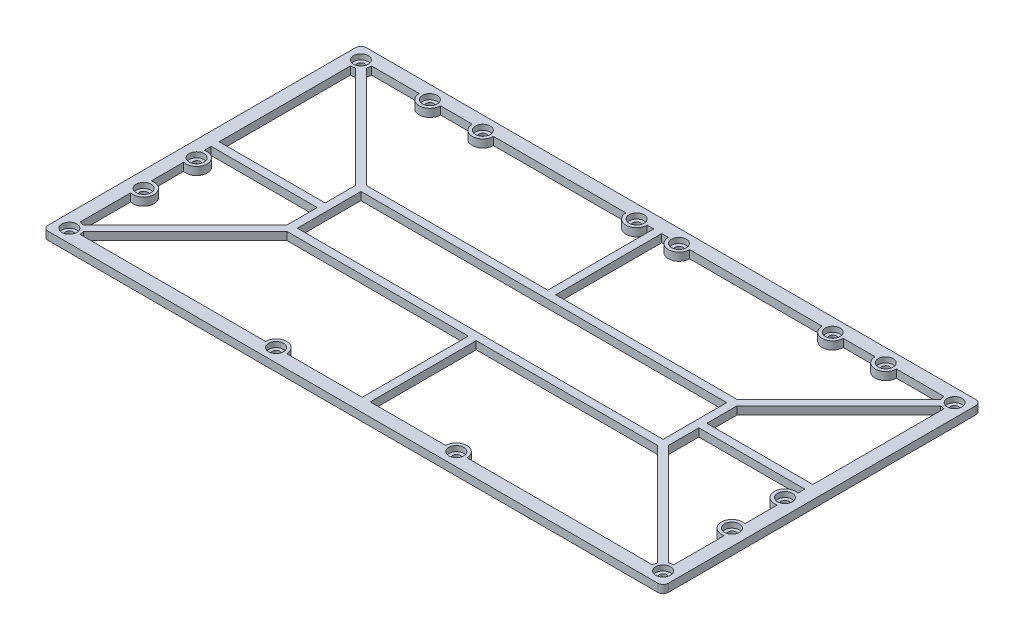
from build123d import *

# Parameters (mm, degrees)
SKETCH_1_W          = 234
SKETCH_1_H          = 120
SKETCH_1_R          = 45
EXTRUDE_1_DEPTH     = 3
SKETCH_2_R          = 1.5
CUT_EXTRUDE_1_DEPTH = 3
SKETCH_3_R          = 1.5
CUT_EXTRUDE_2_DEPTH = 3
SKETCH_4_R          = 1.5
CUT_EXTRUDE_3_DEPTH = 3
SKETCH_5_R          = 1.5
CUT_EXTRUDE_4_DEPTH = 3
FILLET_1_R          = 2
CUT_EXTRUDE_5_DEPTH = 10
EXTRUDE_START       = 17
SKETCH_7_R          = 1.5
EXTRUDE_2_DEPTH     = 17
CUT_EXTRUDE_6_DEPTH = 50
EXTRUDE_START_2     = 20
SKETCH_9_W          = 234
SKETCH_9_H          = 120
SKETCH_9_R          = 1.5
SKETCH_9_W_2        = 138
SKETCH_9_H_2        = 24
EXTRUDE_3_DEPTH     = 3
SKETCH_10_W         = 388.421700004
SKETCH_10_H         = 217.9083871
CUT_EXTRUDE_7_DEPTH = 90
FILLET_2_R          = 2
SKETCH_11_R         = 2.8
CUT_EXTRUDE_8_DEPTH = 2


with BuildPart() as part:
    # 草图1 → 凸台-拉伸1 (new body)
    with BuildSketch(Plane(origin=(0, 0, 0), x_dir=(1, 0, 0), z_dir=(0, 1, 0))):
        Rectangle(SKETCH_1_W, SKETCH_1_H)
        with Locations(Location((-58.5, 0, 0), (0, 0, 270))):
            Circle(SKETCH_1_R, mode=Mode.SUBTRACT)
        with Locations(Location((58.5, 0, 0), (0, 0, 90))):
            Circle(SKETCH_1_R, mode=Mode.SUBTRACT)
    extrude(amount=EXTRUDE_1_DEPTH)

    # 草图2 → 切除-拉伸1 (cut)
    with BuildSketch(Plane(origin=(0, 3, 0), x_dir=(1, 0, 0), z_dir=(0, 1, 0))):
        with Locations(Location((-88.5, -40, 0), (0, 0, 270))):
            Circle(SKETCH_2_R)
        with Locations(Location((-83.5, 43.301270189, 0), (0, 0, 270))):
            Circle(SKETCH_2_R)
        with Locations(Location((-33.5, 43.301270189, 0), (0, 0, 90))):
            Circle(SKETCH_2_R)
        with Locations(Location((-28.5, -40, 0), (0, 0, 90))):
            Circle(SKETCH_2_R)
        with Locations(Location((28.5, -40, 0), (0, 0, 270))):
            Circle(SKETCH_2_R)
        with Locations(Location((88.5, -40, 0), (0, 0, 90))):
            Circle(SKETCH_2_R)
        with Locations(Location((33.5, 43.301270189, 0), (0, 0, 270))):
            Circle(SKETCH_2_R)
        with Locations(Location((83.5, 43.301270189, 0), (0, 0, 90))):
            Circle(SKETCH_2_R)
    extrude(amount=-CUT_EXTRUDE_1_DEPTH, mode=Mode.SUBTRACT)

    # 草图3 → 切除-拉伸2 (cut)
    with BuildSketch(Plane(origin=(0, 3, 0), x_dir=(1, 0, 0), z_dir=(0, 1, 0))):
        with Locations(Location((-111, -28, 0), (0, 0, 270))):
            Circle(SKETCH_3_R)
        with Locations(Location((-111, -8, 0), (0, 0, 270))):
            Circle(SKETCH_3_R)
        with Locations(Location((111, -8, 0), (0, 0, 90))):
            Circle(SKETCH_3_R)
        with Locations(Location((111, -28, 0), (0, 0, 90))):
            Circle(SKETCH_3_R)
        with Locations(Location((-86, 55, 0), (0, 0, 270))):
            Circle(SKETCH_3_R)
        with Locations(Location((-66, 55, 0), (0, 0, 270))):
            Circle(SKETCH_3_R)
        with Locations(Location((66, 55, 0), (0, 0, 90))):
            Circle(SKETCH_3_R)
        with Locations(Location((86, 55, 0), (0, 0, 90))):
            Circle(SKETCH_3_R)
    extrude(amount=-CUT_EXTRUDE_2_DEPTH, mode=Mode.SUBTRACT)

    # 草图4 → 切除-拉伸3 (cut)
    with BuildSketch(Plane(origin=(0, 3, 0), x_dir=(1, 0, 0), z_dir=(0, 1, 0))):
        with Locations(Location((-112, -55, 0), (0, 0, 270))):
            Circle(SKETCH_4_R)
        with Locations(Location((-112, 55, 0), (0, 0, 270))):
            Circle(SKETCH_4_R)
        with Locations(Location((112, 55, 0), (0, 0, 270))):
            Circle(SKETCH_4_R)
        with Locations(Location((112, -55, 0), (0, 0, 270))):
            Circle(SKETCH_4_R)
        with Locations(Location((-34, -55, 0), (0, 0, 270))):
            Circle(SKETCH_4_R)
        with Locations(Location((34, -55, 0), (0, 0, 270))):
            Circle(SKETCH_4_R)
    extrude(amount=-CUT_EXTRUDE_3_DEPTH, mode=Mode.SUBTRACT)

    # 草图5 → 切除-拉伸4 (cut)
    with BuildSketch(Plane(origin=(0, 3, 0), x_dir=(1, 0, 0), z_dir=(0, 1, 0))):
        with Locations(Location((-8, 55, 0), (0, 0, 270))):
            Circle(SKETCH_5_R)
        with Locations(Location((8, 55, 0), (0, 0, 270))):
            Circle(SKETCH_5_R)
    extrude(amount=-CUT_EXTRUDE_4_DEPTH, mode=Mode.SUBTRACT)

    # 圆角1
    fillet_1_edges = [part.edges().sort_by_distance(p)[0] for p in [
        (117, 1.5, 60),
        (-117, 1.5, 60),
        (-117, 1.5, -60),
        (117, 1.5, -60),
    ]]
    fillet(fillet_1_edges, radius=FILLET_1_R)

    # 草图6 → 切除-拉伸5 (cut)
    with BuildSketch(Plane(origin=(0, 3, 0), x_dir=(1, 0, 0), z_dir=(0, 1, 0))):
        with BuildLine():
            Line((109.5, -12.769696007), (109.5, -23.230303993))
            ThreePointArc((109.5, -23.230303993), (106, -28), (109.5, -32.769696007))
            Line((109.5, -32.769696007), (109.5, -50.669872981))
            ThreePointArc((109.5, -50.669872981), (108.464466094, -51.464466094), (107.669872981, -52.5))
            Line((107.669872981, -52.5), (38.330127019, -52.5))
            ThreePointArc((38.330127019, -52.5), (34, -50), (29.669872981, -52.5))
            Line((29.669872981, -52.5), (-29.669872981, -52.5))
            ThreePointArc((-29.669872981, -52.5), (-34, -50), (-38.330127019, -52.5))
            Line((-38.330127019, -52.5), (-107.669872981, -52.5))
            ThreePointArc((-107.669872981, -52.5), (-108.464466094, -51.464466094), (-109.5, -50.669872981))
            Line((-109.5, -50.669872981), (-109.5, -32.769696007))
            ThreePointArc((-109.5, -32.769696007), (-106, -28), (-109.5, -23.230303993))
            Line((-109.5, -23.230303993), (-109.5, -12.769696007))
            ThreePointArc((-109.5, -12.769696007), (-106, -8), (-109.5, -3.230303993))
            Line((-109.5, -3.230303993), (-109.5, 50.669872981))
            ThreePointArc((-109.5, 50.669872981), (-108.464466094, 51.464466094), (-107.669872981, 52.5))
            Line((-107.669872981, 52.5), (-90.330127019, 52.5))
            ThreePointArc((-90.330127019, 52.5), (-86, 50), (-81.669872981, 52.5))
            Line((-81.669872981, 52.5), (-70.330127019, 52.5))
            ThreePointArc((-70.330127019, 52.5), (-66, 50), (-61.669872981, 52.5))
            Line((-61.669872981, 52.5), (-12.330127019, 52.5))
            ThreePointArc((-12.330127019, 52.5), (-8, 50), (-3.669872981, 52.5))
            Line((-3.669872981, 52.5), (3.669872981, 52.5))
            ThreePointArc((3.669872981, 52.5), (8, 50), (12.330127019, 52.5))
            Line((12.330127019, 52.5), (61.669872981, 52.5))
            ThreePointArc((61.669872981, 52.5), (66, 50), (70.330127019, 52.5))
            Line((70.330127019, 52.5), (81.669872981, 52.5))
            ThreePointArc((81.669872981, 52.5), (86, 50), (90.330127019, 52.5))
            Line((90.330127019, 52.5), (107.669872981, 52.5))
            ThreePointArc((107.669872981, 52.5), (108.464466094, 51.464466094), (109.5, 50.669872981))
            Line((109.5, 50.669872981), (109.5, -3.230303993))
            ThreePointArc((109.5, -3.230303993), (106, -8), (109.5, -12.769696007))
        make_face()
    extrude(amount=-CUT_EXTRUDE_5_DEPTH, mode=Mode.SUBTRACT)

    # 草图7 → 凸台-拉伸2 (add)
    with BuildSketch(Plane(origin=(0, 3, 0), x_dir=(1, 0, 0), z_dir=(0, 1, 0)).offset(EXTRUDE_START)):
        with BuildLine():
            Line((-117, 58), (-117, -58))
            ThreePointArc((-117, -58), (-116.414213562, -59.414213562), (-115, -60))
            Line((-115, -60), (115, -60))
            ThreePointArc((115, -60), (116.414213562, -59.414213562), (117, -58))
            Line((117, -58), (117, 58))
            ThreePointArc((117, 58), (116.414213562, 59.414213562), (115, 60))
            Line((115, 60), (-115, 60))
            ThreePointArc((-115, 60), (-116.414213562, 59.414213562), (-117, 58))
        make_face()
        with Locations(Location((112, -55, 0), (0, 0, 270))):
            Circle(SKETCH_7_R, mode=Mode.SUBTRACT)
        with Locations(Location((111, -28, 0), (0, 0, 270))):
            Circle(SKETCH_7_R, mode=Mode.SUBTRACT)
        with Locations(Location((111, -8, 0), (0, 0, 270))):
            Circle(SKETCH_7_R, mode=Mode.SUBTRACT)
        with Locations(Location((112, 55, 0), (0, 0, 270))):
            Circle(SKETCH_7_R, mode=Mode.SUBTRACT)
        with Locations(Location((34, -55, 0), (0, 0, 270))):
            Circle(SKETCH_7_R, mode=Mode.SUBTRACT)
        with Locations(Location((-34, -55, 0), (0, 0, 270))):
            Circle(SKETCH_7_R, mode=Mode.SUBTRACT)
        with Locations(Location((86, 55, 0), (0, 0, 270))):
            Circle(SKETCH_7_R, mode=Mode.SUBTRACT)
        with Locations(Location((66, 55, 0), (0, 0, 270))):
            Circle(SKETCH_7_R, mode=Mode.SUBTRACT)
        with Locations(Location((8, 55, 0), (0, 0, 270))):
            Circle(SKETCH_7_R, mode=Mode.SUBTRACT)
        with Locations(Location((-8, 55, 0), (0, 0, 270))):
            Circle(SKETCH_7_R, mode=Mode.SUBTRACT)
        with Locations(Location((-66, 55, 0), (0, 0, 270))):
            Circle(SKETCH_7_R, mode=Mode.SUBTRACT)
        with Locations(Location((-86, 55, 0), (0, 0, 270))):
            Circle(SKETCH_7_R, mode=Mode.SUBTRACT)
        with Locations(Location((-112, 55, 0), (0, 0, 270))):
            Circle(SKETCH_7_R, mode=Mode.SUBTRACT)
        with Locations(Location((-112, -55, 0), (0, 0, 270))):
            Circle(SKETCH_7_R, mode=Mode.SUBTRACT)
        with Locations(Location((-111, -28, 0), (0, 0, 270))):
            Circle(SKETCH_7_R, mode=Mode.SUBTRACT)
        with Locations(Location((-111, -8, 0), (0, 0, 270))):
            Circle(SKETCH_7_R, mode=Mode.SUBTRACT)
        with BuildLine():
            Line((109.5, -50.669872981), (109.5, -32.769696007))
            ThreePointArc((109.5, -32.769696007), (106, -28), (109.5, -23.230303993))
            Line((109.5, -23.230303993), (109.5, -12.769696007))
            ThreePointArc((109.5, -12.769696007), (106, -8), (109.5, -3.230303993))
            Line((109.5, -3.230303993), (109.5, 50.669872981))
            ThreePointArc((109.5, 50.669872981), (108.464466094, 51.464466094), (107.669872981, 52.5))
            Line((107.669872981, 52.5), (90.330127019, 52.5))
            ThreePointArc((90.330127019, 52.5), (86, 50), (81.669872981, 52.5))
            Line((81.669872981, 52.5), (70.330127019, 52.5))
            ThreePointArc((70.330127019, 52.5), (66, 50), (61.669872981, 52.5))
            Line((61.669872981, 52.5), (12.330127019, 52.5))
            ThreePointArc((12.330127019, 52.5), (8, 50), (3.669872981, 52.5))
            Line((3.669872981, 52.5), (-3.669872981, 52.5))
            ThreePointArc((-3.669872981, 52.5), (-8, 50), (-12.330127019, 52.5))
            Line((-12.330127019, 52.5), (-61.669872981, 52.5))
            ThreePointArc((-61.669872981, 52.5), (-66, 50), (-70.330127019, 52.5))
            Line((-70.330127019, 52.5), (-81.669872981, 52.5))
            ThreePointArc((-81.669872981, 52.5), (-86, 50), (-90.330127019, 52.5))
            Line((-90.330127019, 52.5), (-107.669872981, 52.5))
            ThreePointArc((-107.669872981, 52.5), (-108.464466094, 51.464466094), (-109.5, 50.669872981))
            Line((-109.5, 50.669872981), (-109.5, -3.230303993))
            ThreePointArc((-109.5, -3.230303993), (-106, -8), (-109.5, -12.769696007))
            Line((-109.5, -12.769696007), (-109.5, -23.230303993))
            ThreePointArc((-109.5, -23.230303993), (-106, -28), (-109.5, -32.769696007))
            Line((-109.5, -32.769696007), (-109.5, -50.669872981))
            ThreePointArc((-109.5, -50.669872981), (-108.464466094, -51.464466094), (-107.669872981, -52.5))
            Line((-107.669872981, -52.5), (-38.330127019, -52.5))
            ThreePointArc((-38.330127019, -52.5), (-34, -50), (-29.669872981, -52.5))
            Line((-29.669872981, -52.5), (29.669872981, -52.5))
            ThreePointArc((29.669872981, -52.5), (34, -50), (38.330127019, -52.5))
            Line((38.330127019, -52.5), (107.669872981, -52.5))
            ThreePointArc((107.669872981, -52.5), (108.464466094, -51.464466094), (109.5, -50.669872981))
        make_face(mode=Mode.SUBTRACT)
    extrude(amount=-EXTRUDE_2_DEPTH)

    # 草图8 → 切除-拉伸6 (cut)
    with BuildSketch(Plane(origin=(0, 20, 0), x_dir=(1, 0, 0), z_dir=(0, 1, 0))):
        with BuildLine():
            Line((-90, 55), (-108, 55))
            ThreePointArc((-108, 55), (-109.171572875, 52.171572875), (-112, 51))
            Line((-112, 51), (-112, -4.127016654))
            ThreePointArc((-112, -4.127016654), (-107, -8), (-112, -11.872983346))
            Line((-112, -11.872983346), (-112, -24.127016654))
            ThreePointArc((-112, -24.127016654), (-107, -28), (-112, -31.872983346))
            Line((-112, -31.872983346), (-112, -51))
            ThreePointArc((-112, -51), (-109.171572875, -52.171572875), (-108, -55))
            Line((-108, -55), (-38, -55))
            ThreePointArc((-38, -55), (-34, -51), (-30, -55))
            Line((-30, -55), (30, -55))
            ThreePointArc((30, -55), (34, -51), (38, -55))
            Line((38, -55), (108, -55))
            ThreePointArc((108, -55), (109.171572875, -52.171572875), (112, -51))
            Line((112, -51), (112, -31.872983346))
            ThreePointArc((112, -31.872983346), (107, -28), (112, -24.127016654))
            Line((112, -24.127016654), (112, -11.872983346))
            ThreePointArc((112, -11.872983346), (107, -8), (112, -4.127016654))
            Line((112, -4.127016654), (112, 51))
            ThreePointArc((112, 51), (109.171572875, 52.171572875), (108, 55))
            Line((108, 55), (90, 55))
            ThreePointArc((90, 55), (86, 51), (82, 55))
            Line((82, 55), (70, 55))
            ThreePointArc((70, 55), (66, 51), (62, 55))
            Line((62, 55), (12, 55))
            ThreePointArc((12, 55), (8, 51), (4, 55))
            Line((4, 55), (-4, 55))
            ThreePointArc((-4, 55), (-8, 51), (-12, 55))
            Line((-12, 55), (-62, 55))
            ThreePointArc((-62, 55), (-66, 51), (-70, 55))
            Line((-70, 55), (-82, 55))
            ThreePointArc((-82, 55), (-86, 51), (-90, 55))
        make_face()
    extrude(amount=-CUT_EXTRUDE_6_DEPTH, mode=Mode.SUBTRACT)

    # 草图10 → 切除-拉伸7 (cut)
    with BuildSketch(Plane(origin=(0, 20, 0), x_dir=(1, 0, 0), z_dir=(0, 1, 0))):
        Rectangle(SKETCH_10_W, SKETCH_10_H)
    extrude(amount=-CUT_EXTRUDE_7_DEPTH, mode=Mode.SUBTRACT)


with BuildPart() as body_2:
    # 草图9 → 凸台-拉伸3 (new body)
    with BuildSketch(Plane(origin=(0, 20, 0), x_dir=(1, 0, 0), z_dir=(0, 1, 0)).offset(EXTRUDE_START_2)):
        Rectangle(SKETCH_9_W, SKETCH_9_H)
        with Locations(Location((-112, -55, 0), (0, 0, 270))):
            Circle(SKETCH_9_R, mode=Mode.SUBTRACT)
        with Locations(Location((-111, -28, 0), (0, 0, 270))):
            Circle(SKETCH_9_R, mode=Mode.SUBTRACT)
        with Locations(Location((-111, -8, 0), (0, 0, 270))):
            Circle(SKETCH_9_R, mode=Mode.SUBTRACT)
        with Locations(Location((-112, 55, 0), (0, 0, 270))):
            Circle(SKETCH_9_R, mode=Mode.SUBTRACT)
        with Locations(Location((-66, 55, 0), (0, 0, 270))):
            Circle(SKETCH_9_R, mode=Mode.SUBTRACT)
        with Locations(Location((-86, 55, 0), (0, 0, 270))):
            Circle(SKETCH_9_R, mode=Mode.SUBTRACT)
        with Locations(Location((-8, 55, 0), (0, 0, 270))):
            Circle(SKETCH_9_R, mode=Mode.SUBTRACT)
        with Locations(Location((8, 55, 0), (0, 0, 270))):
            Circle(SKETCH_9_R, mode=Mode.SUBTRACT)
        with Locations(Location((66, 55, 0), (0, 0, 270))):
            Circle(SKETCH_9_R, mode=Mode.SUBTRACT)
        with Locations(Location((86, 55, 0), (0, 0, 270))):
            Circle(SKETCH_9_R, mode=Mode.SUBTRACT)
        with Locations(Location((112, 55, 0), (0, 0, 270))):
            Circle(SKETCH_9_R, mode=Mode.SUBTRACT)
        with Locations(Location((111, -8, 0), (0, 0, 270))):
            Circle(SKETCH_9_R, mode=Mode.SUBTRACT)
        with Locations(Location((111, -28, 0), (0, 0, 270))):
            Circle(SKETCH_9_R, mode=Mode.SUBTRACT)
        with Locations(Location((112, -55, 0), (0, 0, 270))):
            Circle(SKETCH_9_R, mode=Mode.SUBTRACT)
        with Locations(Location((34, -55, 0), (0, 0, 270))):
            Circle(SKETCH_9_R, mode=Mode.SUBTRACT)
        with Locations(Location((-34, -55, 0), (0, 0, 270))):
            Circle(SKETCH_9_R, mode=Mode.SUBTRACT)
        with BuildLine():
            Line((69.878679656, -15), (108.317317708, -53.438638051))
            ThreePointArc((108.317317708, -53.438638051), (108.080132071, -54.203359921), (108, -55))
            Line((108, -55), (38, -55))
            ThreePointArc((38, -55), (34, -51), (30, -55))
            Line((30, -55), (1.5, -55))
            Line((1.5, -55), (1.5, -15))
            Line((1.5, -15), (69.878679656, -15))
        make_face(mode=Mode.SUBTRACT)
        Rectangle(SKETCH_9_W_2, SKETCH_9_H_2, mode=Mode.SUBTRACT)
        with BuildLine():
            Line((-72, 12.878679656), (-72, 1.5))
            Line((-72, 1.5), (-112, 1.5))
            Line((-112, 1.5), (-112, 51))
            ThreePointArc((-112, 51), (-111.203359921, 51.080132071), (-110.438638051, 51.317317708))
            Line((-110.438638051, 51.317317708), (-72, 12.878679656))
        make_face(mode=Mode.SUBTRACT)
        with BuildLine():
            Line((-69.878679656, -15), (-1.5, -15))
            Line((-1.5, -15), (-1.5, -55))
            Line((-1.5, -55), (-30, -55))
            ThreePointArc((-30, -55), (-34, -51), (-38, -55))
            Line((-38, -55), (-108, -55))
            ThreePointArc((-108, -55), (-108.080132071, -54.203359921), (-108.317317708, -53.438638051))
            Line((-108.317317708, -53.438638051), (-69.878679656, -15))
        make_face(mode=Mode.SUBTRACT)
        with BuildLine():
            Line((72, 12.878679656), (72, 1.5))
            Line((72, 1.5), (112, 1.5))
            Line((112, 1.5), (112, 51))
            ThreePointArc((112, 51), (111.203359921, 51.080132071), (110.438638051, 51.317317708))
            Line((110.438638051, 51.317317708), (72, 12.878679656))
        make_face(mode=Mode.SUBTRACT)
        with BuildLine():
            Line((-69.878679656, 15), (-1.5, 15))
            Line((-1.5, 15), (-1.5, 55))
            Line((-1.5, 55), (-4, 55))
            ThreePointArc((-4, 55), (-8, 51), (-12, 55))
            Line((-12, 55), (-62, 55))
            ThreePointArc((-62, 55), (-66, 51), (-70, 55))
            Line((-70, 55), (-82, 55))
            ThreePointArc((-82, 55), (-86, 51), (-90, 55))
            Line((-90, 55), (-108, 55))
            ThreePointArc((-108, 55), (-108.080132071, 54.203359921), (-108.317317708, 53.438638051))
            Line((-108.317317708, 53.438638051), (-69.878679656, 15))
        make_face(mode=Mode.SUBTRACT)
        with BuildLine():
            Line((72, -1.5), (112, -1.5))
            Line((112, -1.5), (112, -4.127016654))
            ThreePointArc((112, -4.127016654), (107, -8), (112, -11.872983346))
            Line((112, -11.872983346), (112, -24.127016654))
            ThreePointArc((112, -24.127016654), (107, -28), (112, -31.872983346))
            Line((112, -31.872983346), (112, -51))
            ThreePointArc((112, -51), (111.203359921, -51.080132071), (110.438638051, -51.317317708))
            Line((110.438638051, -51.317317708), (72, -12.878679656))
            Line((72, -12.878679656), (72, -1.5))
        make_face(mode=Mode.SUBTRACT)
        with BuildLine():
            Line((69.878679656, 15), (108.317317708, 53.438638051))
            ThreePointArc((108.317317708, 53.438638051), (108.080132071, 54.203359921), (108, 55))
            Line((108, 55), (90, 55))
            ThreePointArc((90, 55), (86, 51), (82, 55))
            Line((82, 55), (70, 55))
            ThreePointArc((70, 55), (66, 51), (62, 55))
            Line((62, 55), (12, 55))
            ThreePointArc((12, 55), (8, 51), (4, 55))
            Line((4, 55), (1.5, 55))
            Line((1.5, 55), (1.5, 15))
            Line((1.5, 15), (69.878679656, 15))
        make_face(mode=Mode.SUBTRACT)
        with BuildLine():
            Line((-72, -12.878679656), (-110.438638051, -51.317317708))
            ThreePointArc((-110.438638051, -51.317317708), (-111.203359921, -51.080132071), (-112, -51))
            Line((-112, -51), (-112, -31.872983346))
            ThreePointArc((-112, -31.872983346), (-107, -28), (-112, -24.127016654))
            Line((-112, -24.127016654), (-112, -11.872983346))
            ThreePointArc((-112, -11.872983346), (-107, -8), (-112, -4.127016654))
            Line((-112, -4.127016654), (-112, -1.5))
            Line((-112, -1.5), (-72, -1.5))
            Line((-72, -1.5), (-72, -12.878679656))
        make_face(mode=Mode.SUBTRACT)
    extrude(amount=EXTRUDE_3_DEPTH)

    # 圆角2
    fillet_2_edges = [body_2.edges().sort_by_distance(p)[0] for p in [
        (117, 41.5, 60),
        (-117, 41.5, 60),
        (-117, 41.5, -60),
        (117, 41.5, -60),
    ]]
    fillet(fillet_2_edges, radius=FILLET_2_R)

    # 草图11 → 切除-拉伸8 (cut)
    with BuildSketch(Plane(origin=(0, 43, 0), x_dir=(1, 0, 0), z_dir=(0, 1, 0))):
        with Locations(Location((-112, 55, 0), (0, 0, 270))):
            Circle(SKETCH_11_R)
        with Locations(Location((-86, 55, 0), (0, 0, 270))):
            Circle(SKETCH_11_R)
        with Locations(Location((-66, 55, 0), (0, 0, 270))):
            Circle(SKETCH_11_R)
        with Locations(Location((-111, -8, 0), (0, 0, 270))):
            Circle(SKETCH_11_R)
        with Locations(Location((-111, -28, 0), (0, 0, 270))):
            Circle(SKETCH_11_R)
        with Locations(Location((-112, -55, 0), (0, 0, 270))):
            Circle(SKETCH_11_R)
        with Locations(Location((-34, -55, 0), (0, 0, 270))):
            Circle(SKETCH_11_R)
        with Locations(Location((34, -55, 0), (0, 0, 270))):
            Circle(SKETCH_11_R)
        with Locations(Location((112, -55, 0), (0, 0, 270))):
            Circle(SKETCH_11_R)
        with Locations(Location((-8, 55, 0), (0, 0, 270))):
            Circle(SKETCH_11_R)
        with Locations(Location((8, 55, 0), (0, 0, 270))):
            Circle(SKETCH_11_R)
        with Locations(Location((66, 55, 0), (0, 0, 270))):
            Circle(SKETCH_11_R)
        with Locations(Location((86, 55, 0), (0, 0, 270))):
            Circle(SKETCH_11_R)
        with Locations(Location((112, 55, 0), (0, 0, 270))):
            Circle(SKETCH_11_R)
        with Locations(Location((111, -8, 0), (0, 0, 270))):
            Circle(SKETCH_11_R)
        with Locations(Location((111, -28, 0), (0, 0, 270))):
            Circle(SKETCH_11_R)
    extrude(amount=-CUT_EXTRUDE_8_DEPTH, mode=Mode.SUBTRACT)


solid = body_2.part
